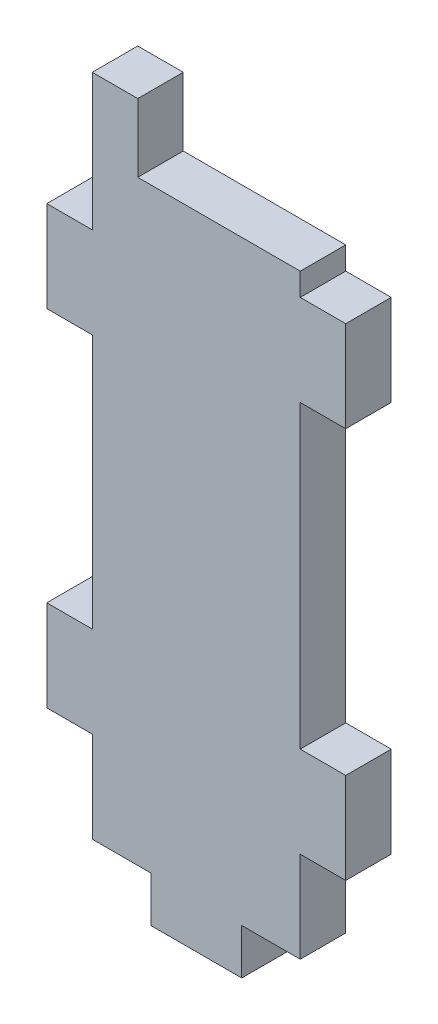
from build123d import *

# Parameters (mm, degrees)
ESQUISSE1_W             = 32.86
ESQUISSE1_H             = 73
BOSS_EXTRU_1_DEPTH      = 5
ESQUISSE2_W             = 5
ESQUISSE2_H             = 33
ESQUISSE2_H_2           = 15
ESQUISSE2_H_3           = 10
ESQUISSE2_H_4           = 28
ENL_V_MAT_EXTRU_1_DEPTH = 5
ESQUISSE3_W             = 10
ESQUISSE3_H             = 5
BOSS_EXTRU_2_DEPTH      = 5


with BuildPart() as part:
    # Esquisse1 → Boss.-Extru.1 (new body)
    with BuildSketch(Plane.XY):
        with Locations((159.387093212, -0.522583191)):
            Rectangle(ESQUISSE1_W, ESQUISSE1_H)
    extrude(amount=BOSS_EXTRU_1_DEPTH)

    # Esquisse2 → Enlèv. mat.-Extru.1 (cut)
    with BuildSketch(Plane.XY.offset(5)):
        Polygon((170.817093212, 25.977416809), (170.817093212, 28.477416809), (152.957093212, 28.477416809), (152.957093212, 35.977416809), (175.817093212, 35.977416809), (175.817093212, 25.977416809), align=None)
        with Locations((173.317093212, -0.522583191)):
            Rectangle(ESQUISSE2_W, ESQUISSE2_H)
        with Locations((145.457093212, 28.477416809)):
            Rectangle(ESQUISSE2_W, ESQUISSE2_H_2)
        with Locations((173.317093212, -32.022583191)):
            Rectangle(ESQUISSE2_W, ESQUISSE2_H_3)
        with Locations((145.457093212, -32.022583191)):
            Rectangle(ESQUISSE2_W, ESQUISSE2_H_3)
        with Locations((145.457093212, -3.022583191)):
            Rectangle(ESQUISSE2_W, ESQUISSE2_H_4)
    extrude(amount=-ENL_V_MAT_EXTRU_1_DEPTH, mode=Mode.SUBTRACT)

    # Esquisse3 → Boss.-Extru.2 (add)
    with BuildSketch(Plane.XY.offset(5)):
        with Locations((159.387093212, -39.522583191)):
            Rectangle(ESQUISSE3_W, ESQUISSE3_H)
    extrude(amount=-BOSS_EXTRU_2_DEPTH)


solid = part.part
